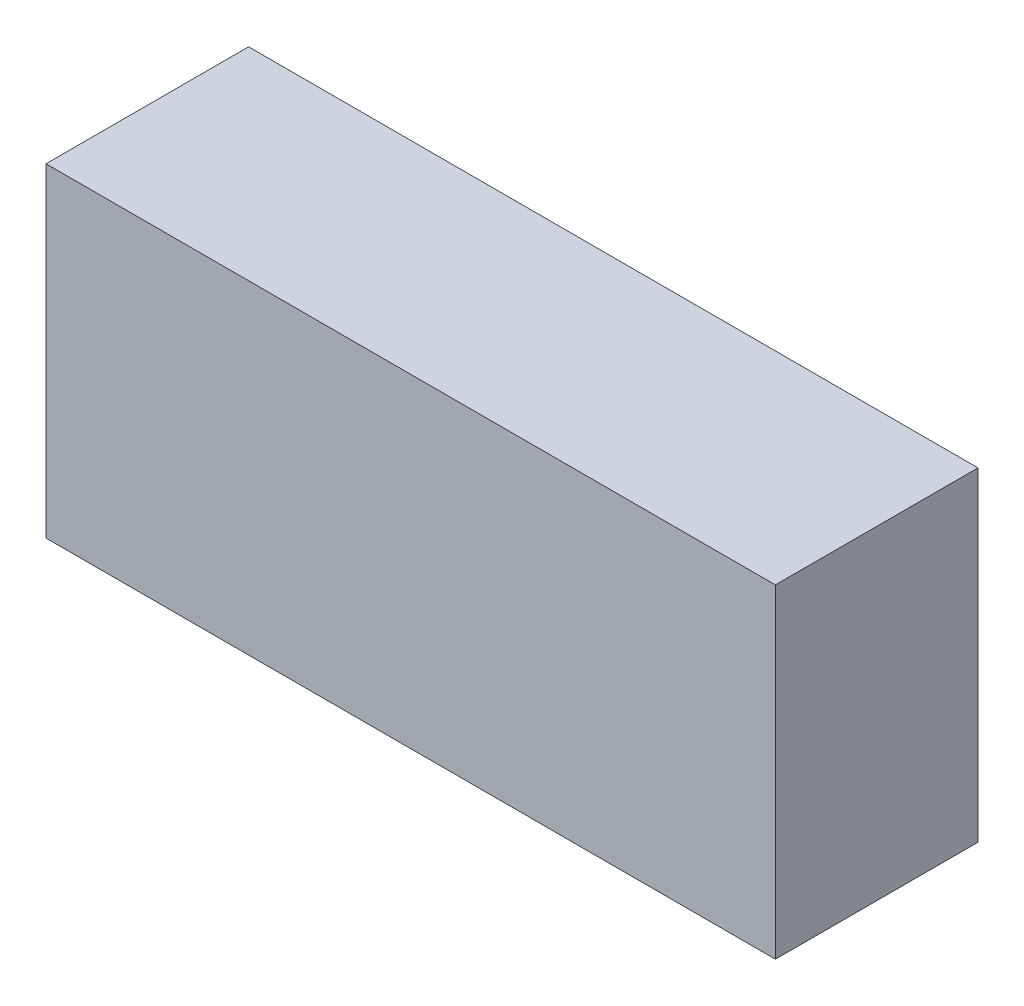
from build123d import *

# Parameters (mm, degrees)
SKETCH_1_W      = 72
SKETCH_1_H      = 32
EXTRUDE_1_DEPTH = 10


with BuildPart() as part:
    # 草图1 → 凸台-拉伸1 (new, symmetric)
    with BuildSketch(Plane.XY):
        Rectangle(SKETCH_1_W, SKETCH_1_H)
    extrude(amount=EXTRUDE_1_DEPTH, both=True)


solid = part.part
